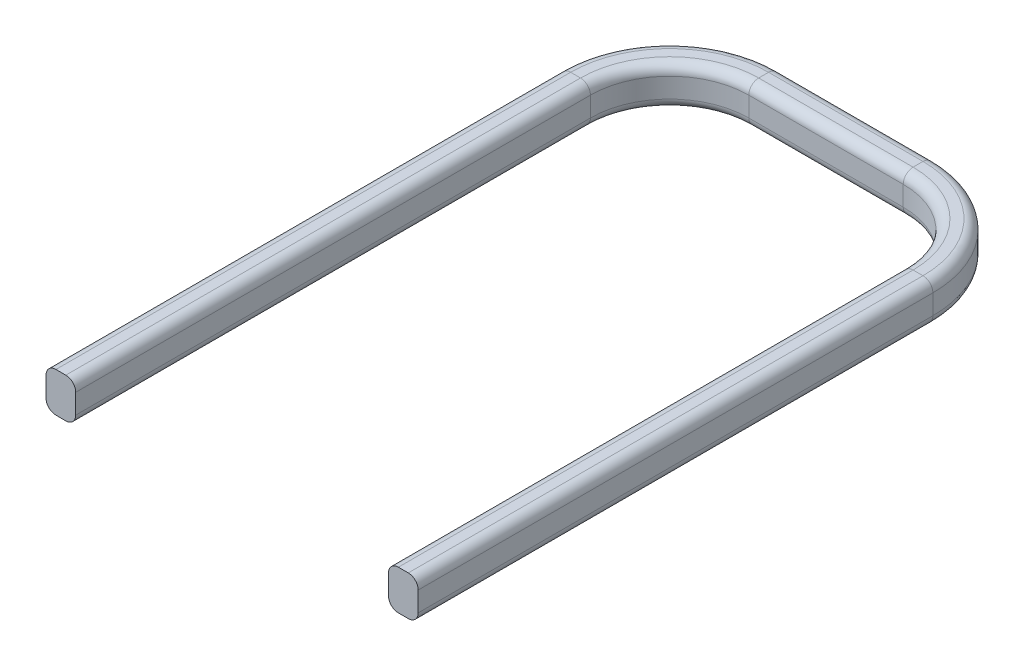
from build123d import *

# Parameters (mm, degrees)
SKETCH2_W = 0.75
SKETCH2_H = 1
FILLET1_R = 0.25


with BuildPart() as part:
    # Sweep1: sweep along a path in Sketch1
    with BuildLine(Plane(origin=(0, 0, 0), x_dir=(1, 0, 0), z_dir=(0, 1, 0))) as sweep1_path:
        Line((-3.95, 0), (-3.95, 13))
        ThreePointArc((-3.95, 13), (-3.364213562, 14.414213562), (-1.95, 15))
        Line((-1.95, 15), (1.95, 15))
        ThreePointArc((1.95, 15), (3.364213562, 14.414213562), (3.95, 13))
        Line((3.95, 13), (3.95, 0))
    # Sketch2 → Sweep1 (sweep)
    with BuildSketch(Plane.XY):
        with Locations((-4.325, 0.5)):
            Rectangle(SKETCH2_W, SKETCH2_H)
    sweep(path=sweep1_path.line)

    # Fillet1
    fillet1_edges = [part.edges().sort_by_distance(p)[0] for p in [
        (-3.95, 1, -6.5),
        (-4.7, 1, -6.5),
        (-4.7, 0, -6.5),
        (3.95, 0, -6.5),
        (3.95, 1, -6.5),
        (4.7, 1, -6.5),
        (4.7, 0, -6.5),
        (3.364213562, 0, -14.414213562),
        (3.364213562, 1, -14.414213562),
        (3.894543648, 1, -14.944543648),
        (3.894543648, 0, -14.944543648),
        (0, 0, -15),
        (0, 1, -15),
        (0, 1, -15.75),
        (0, 0, -15.75),
        (-3.364213562, 0, -14.414213562),
        (-3.364213562, 1, -14.414213562),
        (-3.894543648, 1, -14.944543648),
        (-3.894543648, 0, -14.944543648),
        (-3.95, 0, -6.5),
    ]]
    fillet(fillet1_edges, radius=FILLET1_R)


solid = part.part
